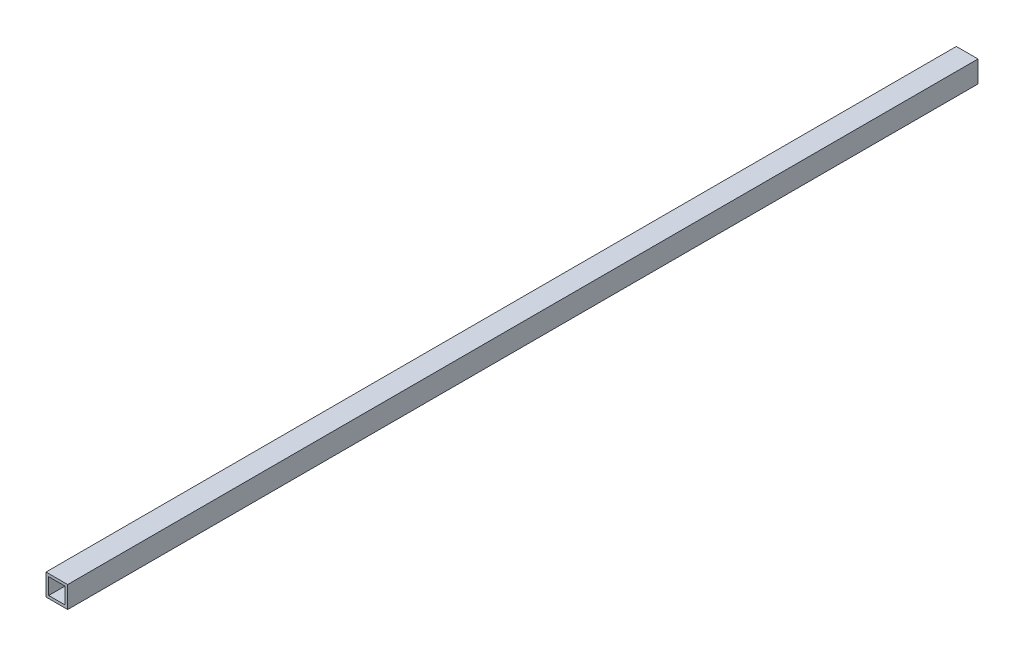
from build123d import *

# Parameters (mm, degrees)
BOSS_EXTRUDE1_DEPTH      = 533.4
BOSS_EXTRUDE1_DEPTH_BACK = 533.4
SKETCH3_W                = 25.4
SKETCH3_H                = 25.4
SKETCH3_W_2              = 19.05
SKETCH3_H_2              = 19.05


with BuildPart() as part:
    # Sketch3 → Boss-Extrude1 (new, two sides: drawn at the far end of the back side and taken through both)
    with BuildSketch(Plane.XY.offset(-BOSS_EXTRUDE1_DEPTH_BACK)):
        Rectangle(SKETCH3_W, SKETCH3_H)
        Rectangle(SKETCH3_W_2, SKETCH3_H_2, mode=Mode.SUBTRACT)
    extrude(amount=BOSS_EXTRUDE1_DEPTH + BOSS_EXTRUDE1_DEPTH_BACK)


solid = part.part
